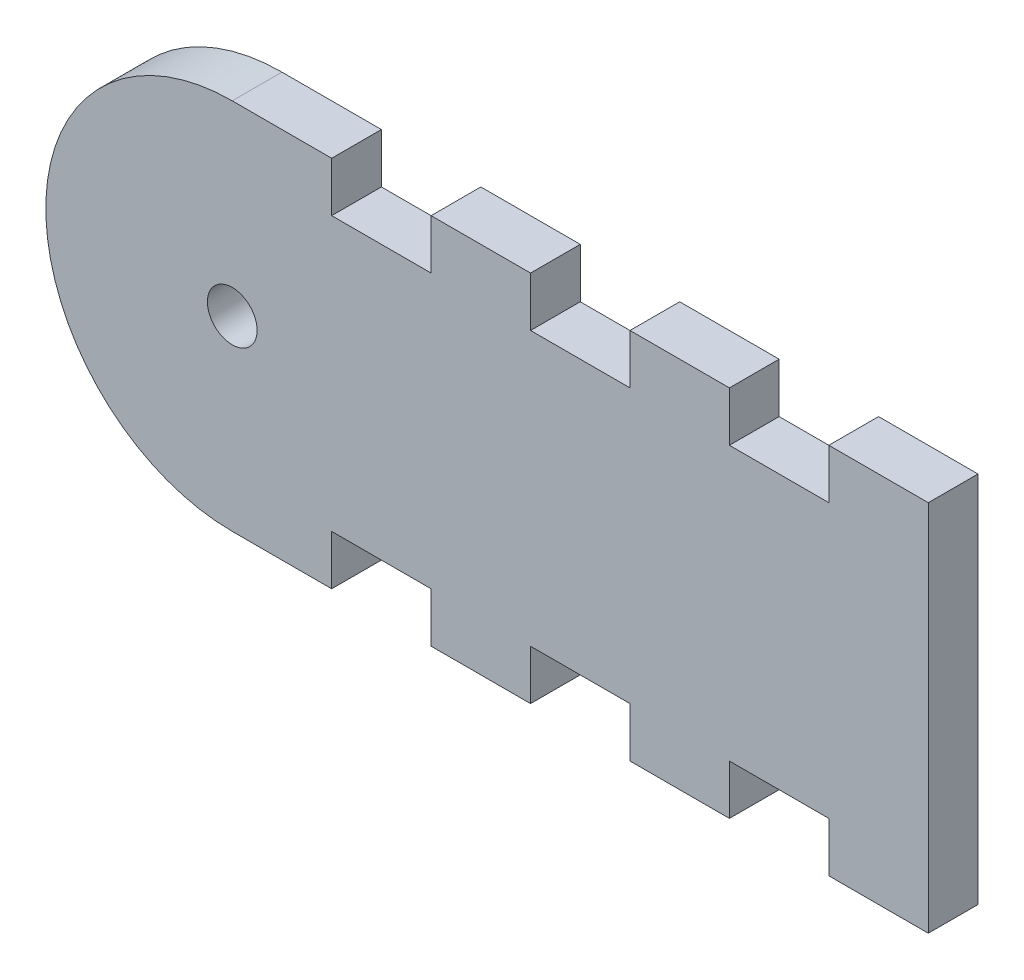
from build123d import *

# Parameters (mm, degrees)
MASS_DEPTH         = 6.35
SKETCH4_R          = 3.175
CUT_EXTRUDE1_DEPTH = 73.574972012
SKETCH3_W          = 12.7
SKETCH3_H          = 12.7
CUT_EXTRUDE2_DEPTH = 73.574972012
LPATTERN1_COUNT    = 3
LPATTERN1_PITCH    = 25.4


with BuildPart() as part:
    # Sketch1 → Mass (new body)
    with BuildSketch(Plane.XY):
        with BuildLine():
            Line((-44.45, -23.8125), (44.45, -23.8125))
            Line((44.45, -23.8125), (44.45, 23.8125))
            Line((44.45, 23.8125), (-44.45, 23.8125))
            ThreePointArc((-44.45, 23.8125), (-68.2625, 0), (-44.45, -23.8125))
        make_face()
    extrude(amount=MASS_DEPTH)

    # Sketch4 → Cut-Extrude1 (cut, through all)
    with BuildSketch(Plane(origin=(0, 0, 0), x_dir=(-1, 0, 0), z_dir=(0, 0, -1))):
        with Locations((44.45, 0)):
            Circle(SKETCH4_R)
    extrude(amount=-CUT_EXTRUDE1_DEPTH, mode=Mode.SUBTRACT)

    # Sketch3 → Cut-Extrude2 (cut, through all)
    with BuildSketch(Plane(origin=(0, 0, 0), x_dir=(-1, 0, 0), z_dir=(0, 0, -1))):
        with Locations((-25.4, 23.8125)):
            Rectangle(SKETCH3_W, SKETCH3_H)
        with Locations((-25.4, -23.8125)):
            Rectangle(SKETCH3_W, SKETCH3_H)
    cut_extrude2 = extrude(amount=-CUT_EXTRUDE2_DEPTH, mode=Mode.SUBTRACT)

    # LPattern1: Cut-Extrude2 ×3
    with Locations(*[(-i * LPATTERN1_PITCH, 0, 0) for i in range(1, LPATTERN1_COUNT)]):
        add(cut_extrude2, mode=Mode.SUBTRACT)


solid = part.part
